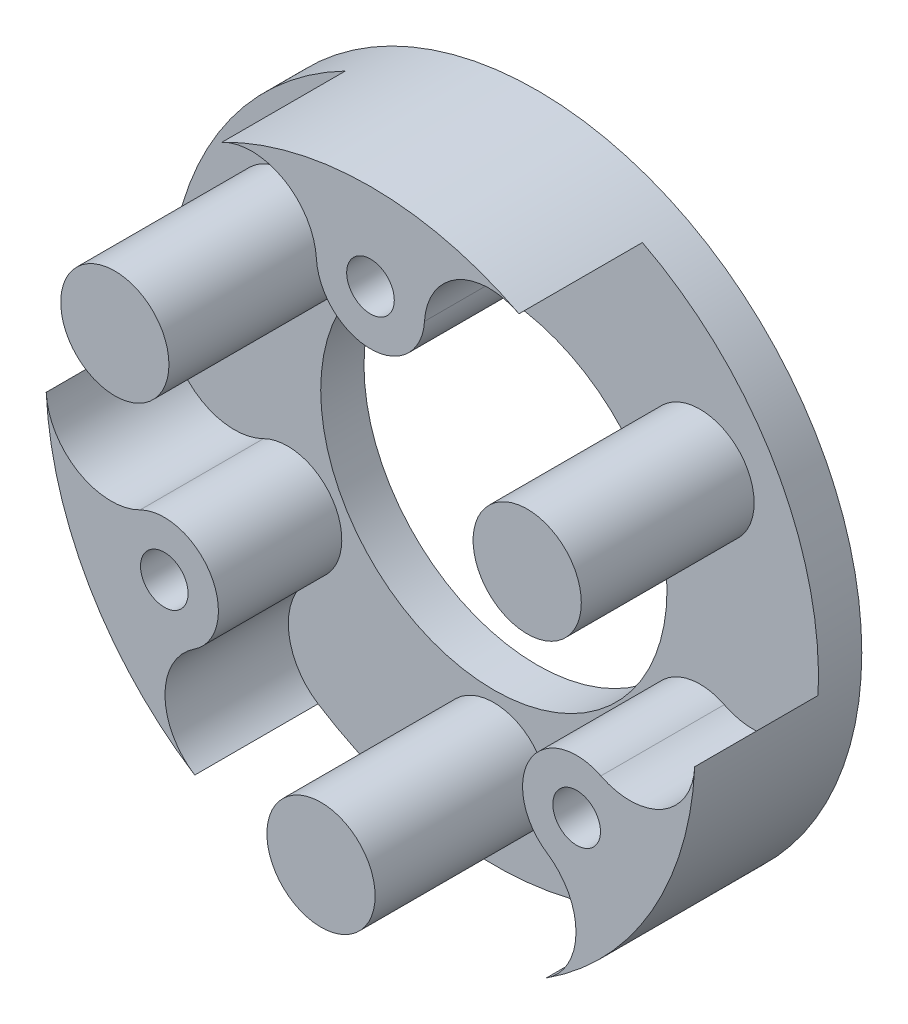
from build123d import *

# Parameters (mm, degrees)
SKETCH1_R           = 15
SKETCH1_R_2         = 8
SKETCH1_R_3         = 1.5
BOSS_EXTRUDE1_DEPTH = 2
SKETCH2_R           = 2.5
SKETCH2_R_2         = 1.5
BOSS_EXTRUDE2_DEPTH = 7.985619116
SKETCH3_R           = 1.1
BOSS_EXTRUDE3_DEPTH = 5.7


with BuildPart() as part:
    # Sketch1 → Boss-Extrude1 (new body)
    with BuildSketch(Plane.XY):
        Circle(SKETCH1_R)
        Circle(SKETCH1_R_2, mode=Mode.SUBTRACT)
        with Locations((9.526279442, 5.5)):
            Circle(SKETCH1_R_3, mode=Mode.SUBTRACT)
        with Locations((0, -11)):
            Circle(SKETCH1_R_3, mode=Mode.SUBTRACT)
        with Locations((-9.526279442, 5.5)):
            Circle(SKETCH1_R_3, mode=Mode.SUBTRACT)
    extrude(amount=BOSS_EXTRUDE1_DEPTH)

    # Sketch2 → Boss-Extrude2 (add)
    # profile 1 of 6: a face of its own
    with BuildSketch(Plane.XY.offset(2)):
        with Locations((-9.526279442, 5.5)):
            Circle(SKETCH2_R)
        with Locations((-9.526279442, 5.5)):
            Circle(SKETCH2_R_2, mode=Mode.SUBTRACT)
    # profile 2 of 6: a face of its own
    with BuildSketch(Plane.XY.offset(2)):
        with Locations((9.526279442, 5.5)):
            Circle(SKETCH2_R)
        with Locations((9.526279442, 5.5)):
            Circle(SKETCH2_R_2, mode=Mode.SUBTRACT)
    # profile 3 of 6: a face of its own
    with BuildSketch(Plane.XY.offset(2)):
        with Locations((-9.526279442, 5.5)):
            Circle(SKETCH2_R_2)
    # profile 4 of 6: a face of its own
    with BuildSketch(Plane.XY.offset(2)):
        with Locations((9.526279442, 5.5)):
            Circle(SKETCH2_R_2)
    # profile 5 of 6: a face of its own
    with BuildSketch(Plane.XY.offset(2)):
        with Locations((0, -11)):
            Circle(SKETCH2_R)
        with Locations((0, -11)):
            Circle(SKETCH2_R_2, mode=Mode.SUBTRACT)
    # profile 6 of 6: a face of its own
    with BuildSketch(Plane.XY.offset(2)):
        with Locations((0, -11)):
            Circle(SKETCH2_R_2)
    extrude(amount=BOSS_EXTRUDE2_DEPTH)

    # Sketch3 → Boss-Extrude3 (add)
    # profile 1 of 4: a face of its own
    with BuildSketch(Plane.XY.offset(2)):
        with BuildLine():
            ThreePointArc((-10.644308739, -3.263929677), (-13.500919136, -3.170017803), (-14.982429868, -0.725806611))
            ThreePointArc((-14.982429868, -0.725806611), (-12.990381057, -7.5), (-8.119781897, -12.612261571))
            ThreePointArc((-8.119781897, -12.612261571), (-9.495775516, -10.107130045), (-8.148800385, -7.586276935))
            ThreePointArc((-8.148800385, -7.586276935), (-7.361215932, -4.25), (-10.644308739, -3.263929677))
        make_face()
        with Locations((-9.526279442, -5.5)):
            Circle(SKETCH3_R, mode=Mode.SUBTRACT)
    # profile 2 of 4: a face of its own
    with BuildSketch(Plane.XY.offset(2)):
        with BuildLine():
            ThreePointArc((8.119781897, -12.612261571), (12.990381057, -7.5), (14.982429868, -0.725806611))
            ThreePointArc((14.982429868, -0.725806611), (13.500919136, -3.170017803), (10.644308739, -3.263929677))
            ThreePointArc((10.644308739, -3.263929677), (7.361215932, -4.25), (8.148800385, -7.586276935))
            ThreePointArc((8.148800385, -7.586276935), (9.495775516, -10.107130045), (8.119781897, -12.612261571))
        make_face()
        with Locations((9.526279442, -5.5)):
            Circle(SKETCH3_R, mode=Mode.SUBTRACT)
    # profile 3 of 4: a face of its own
    with BuildSketch(Plane.XY.offset(2)):
        with BuildLine():
            ThreePointArc((-2.495508353, 10.850206612), (-1.713988992, 9.18004348), (0, 8.5))
            Line((0, 8.5), (0, 9.9))
            ThreePointArc((0, 9.9), (-1.1, 11), (0, 12.1))
            Line((0, 12.1), (0, 15))
            ThreePointArc((0, 15), (-3.530508269, 14.578597716), (-6.862647971, 13.338068182))
            ThreePointArc((-6.862647971, 13.338068182), (-4.00514362, 13.277147848), (-2.495508353, 10.850206612))
        make_face()
    # profile 4 of 4: a face of its own
    with BuildSketch(Plane.XY.offset(2)):
        with BuildLine():
            Line((0, 9.9), (0, 8.5))
            ThreePointArc((0, 8.5), (1.713988992, 9.18004348), (2.495508353, 10.850206612))
            ThreePointArc((2.495508353, 10.850206612), (4.00514362, 13.277147848), (6.862647971, 13.338068182))
            ThreePointArc((6.862647971, 13.338068182), (3.530508269, 14.578597716), (0, 15))
            Line((0, 15), (0, 12.1))
            ThreePointArc((0, 12.1), (0.777817459, 11.777817459), (1.1, 11))
            ThreePointArc((1.1, 11), (0.777817459, 10.222182541), (0, 9.9))
        make_face()
    extrude(amount=BOSS_EXTRUDE3_DEPTH)


solid = part.part
